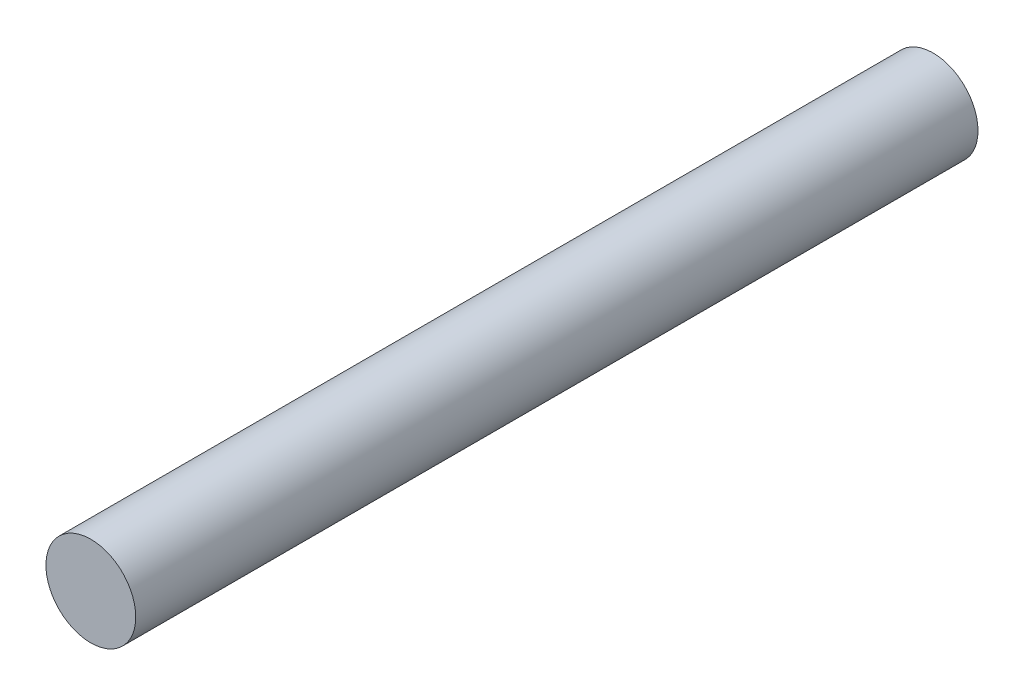
from build123d import *

# Parameters (mm, degrees)
SKETCH1_R           = 8
BOSS_EXTRUDE1_DEPTH = 150


with BuildPart() as part:
    # Sketch1 → Boss-Extrude1 (new body)
    with BuildSketch(Plane.XY):
        Circle(SKETCH1_R)
    extrude(amount=BOSS_EXTRUDE1_DEPTH)


solid = part.part
